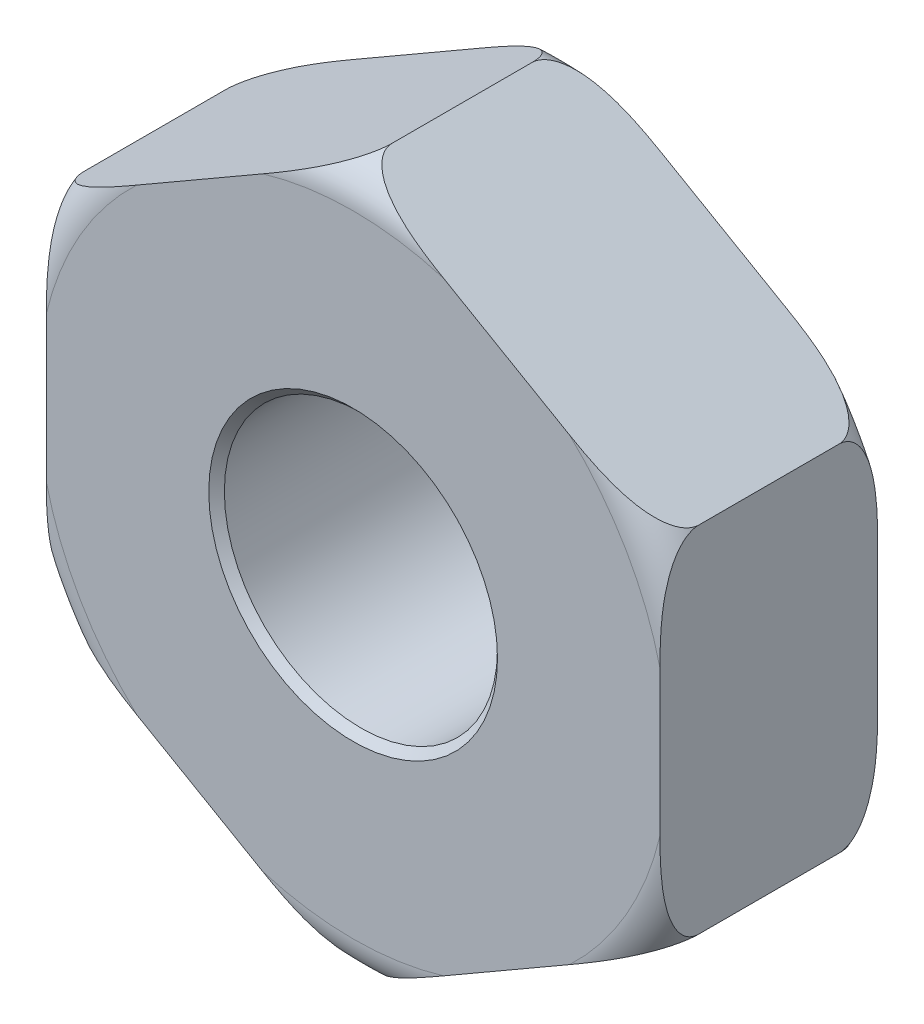
from build123d import *

# Parameters (mm, degrees)
SKETCH1_R          = 1.7525
BASE_EXTRUDE_DEPTH = 1.397


with BuildPart() as part:
    # Sketch1 → Base-Extrude (new, symmetric)
    with BuildSketch(Plane.XY):
        Polygon((0, 4.54605602), (-3.937, 2.27302801), (-3.937, -2.27302801), (0, -4.54605602), (3.937, -2.27302801), (3.937, 2.27302801), align=None)
        Circle(SKETCH1_R, mode=Mode.SUBTRACT)
    extrude(amount=BASE_EXTRUDE_DEPTH, both=True)

    # Sketch2 → DetailCut (revolve, cut)
    with BuildSketch(Plane(origin=(0, 0, 0), x_dir=(0, 0, -1), z_dir=(1, 0, 0)), mode=Mode.PRIVATE) as detailcut_sk:
        Polygon((-1.397, 1.7525), (-1.397, 1.8525), (-1.297, 1.7525), align=None)
        with BuildLine():
            Line((-1.397, 4.54605602), (-1.397, 4.04605602))
            ThreePointArc((-1.397, 4.04605602), (-1.250553391, 4.39960941), (-0.897, 4.54605602))
            Line((-0.897, 4.54605602), (-1.397, 4.54605602))
        make_face()
        with BuildLine():
            Line((1.397, 4.54605602), (0.897, 4.54605602))
            ThreePointArc((0.897, 4.54605602), (1.250553391, 4.39960941), (1.397, 4.04605602))
            Line((1.397, 4.04605602), (1.397, 4.54605602))
        make_face()
        Polygon((1.297, 1.7525), (1.397, 1.7525), (1.397, 1.8525), align=None)
    revolve(detailcut_sk.sketch.rotate(Axis((0, 0, 0), (0, 0, -1)), 90), axis=Axis((0, 0, 0), (0, 0, -1)), mode=Mode.SUBTRACT)


solid = part.part
